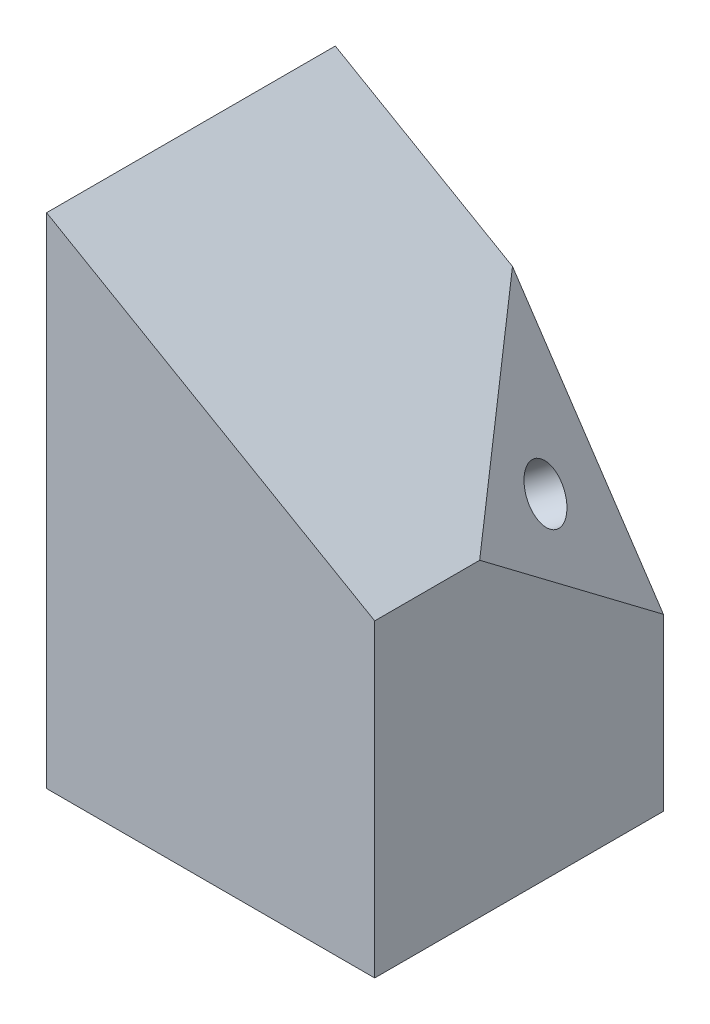
from build123d import *

# Parameters (mm, degrees)
SKETCH2_W           = 50
SKETCH2_H           = 44
BOSS_EXTRUDE2_DEPTH = 76
CUT_EXTRUDE1_DEPTH  = 76
CUT_EXTRUDE2_DEPTH  = 76
SKETCH14_R          = 4
CUT_EXTRUDE3_DEPTH  = 20


with BuildPart() as part:
    # Sketch2 → Boss-Extrude2 (new body)
    with BuildSketch(Plane(origin=(0, 0, 0), x_dir=(1, 0, 0), z_dir=(0, 1, 0))):
        with Locations((-25, 22)):
            Rectangle(SKETCH2_W, SKETCH2_H)
    extrude(amount=BOSS_EXTRUDE2_DEPTH)

    # Sketch3 → Cut-Extrude1 (cut)
    with BuildSketch(Plane.XY):
        Polygon((-50, 76), (0, 47.132486541), (0, 76), align=None)
    extrude(amount=-CUT_EXTRUDE1_DEPTH, mode=Mode.SUBTRACT)

    # Sketch10 → Cut-Extrude2 (cut)
    with BuildSketch(Plane(origin=(23.262165395, 15.547974941, -11.734548971), x_dir=(0.3215470193165547, 0.21491571888839583, 0.9221815158326062), z_dir=(-0.7666944497450301, -0.5124435274969221, 0.38675735527159244))):
        Polygon((-4.625392025, 39.185578124), (-34.988178006, 63.006463096), (-34.988178006, 21.61619524), align=None)
    extrude(amount=-CUT_EXTRUDE2_DEPTH, mode=Mode.SUBTRACT)

    # Sketch14 → Cut-Extrude3 (cut)
    with BuildSketch(Plane(origin=(23.262165395, 15.547974941, -11.734548971), x_dir=(0.3215470193165547, 0.21491571888839583, 0.9221815158326062), z_dir=(-0.7666944497450301, -0.5124435274969221, 0.38675735527159244))):
        with Locations(Location((-22.531650424, 40.498325306, 0), (0, 0, 270))):
            Circle(SKETCH14_R)
    extrude(amount=CUT_EXTRUDE3_DEPTH, mode=Mode.SUBTRACT)


solid = part.part
